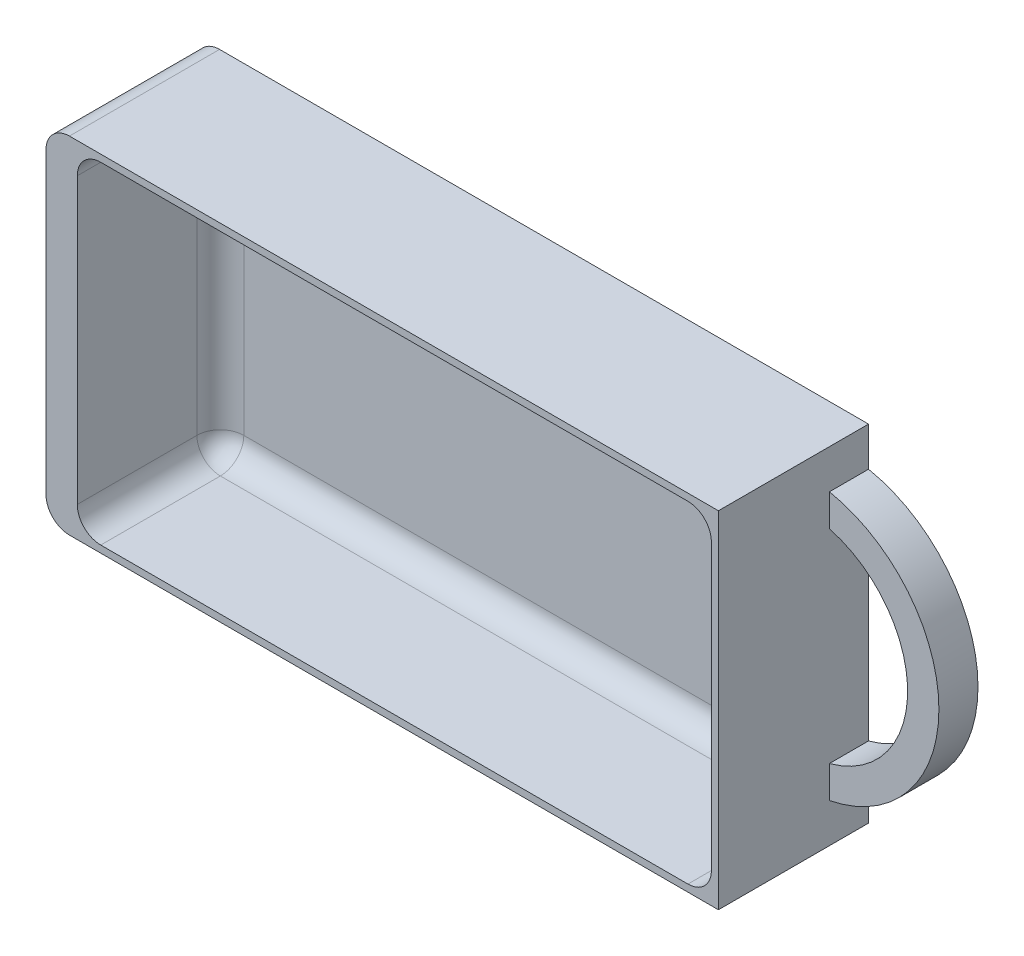
from build123d import *

# Parameters (mm, degrees)
SKETCH_1_W                  = 86
SKETCH_1_H                  = 44.2
EXTRUDE_1_DEPTH             = 14.2
EXTRUDE_2_DEPTH             = 5
SKETCH_3_W                  = 81.1
SKETCH_3_H                  = 42.4
CUT_EXTRUDE_1_DEPTH         = 18.3
HOLE_WIZARD_8_3_8_3_1_D     = 8.3
HOLE_WIZARD_8_3_8_3_1_DEPTH = 3.2
FILLET_1_R                  = 3
FILLET_2_R                  = 3
FILLET_3_R                  = 3
FILLET_4_R                  = 3
FILLET_5_R                  = 3
EXTRUDE_START               = -3
SKETCH_6_R                  = 4.15
EXTRUDE_3_DEPTH             = 3


with BuildPart() as part:
    # Эскиз1 → Бобышка-Вытянуть1 (new body)
    with BuildSketch(Plane.XY.offset(9.6)):
        with Locations((47, 0)):
            Rectangle(SKETCH_1_W, SKETCH_1_H)
    extrude(amount=-EXTRUDE_1_DEPTH)

    # Эскиз2 → Бобышка-Вытянуть2 (add)
    with BuildSketch(Plane(origin=(0, 0, -4.6), x_dir=(-1, 0, 0), z_dir=(0, 0, -1))):
        with BuildLine():
            Line((-90, -22.1), (-90, -17.1))
            ThreePointArc((-90, -17.1), (-104, 0), (-90, 17.1))
            Line((-90, 17.1), (-90, 22.1))
            Line((-90, 22.1), (-4, 22.1))
            Line((-4, 22.1), (-4, -22.1))
            Line((-4, -22.1), (-90, -22.1))
        make_face()
        with BuildLine():
            Line((-90, -12.994779171), (-90, 12.994779171))
            ThreePointArc((-90, 12.994779171), (-100, 0), (-90, -12.994779171))
        make_face(mode=Mode.SUBTRACT)
    extrude(amount=EXTRUDE_2_DEPTH)

    # Эскиз3 → Вырез-Вытянуть1 (cut)
    with BuildSketch(Plane.XY.offset(9.6)):
        with Locations((48.55, 0)):
            Rectangle(SKETCH_3_W, SKETCH_3_H)
    extrude(amount=-CUT_EXTRUDE_1_DEPTH, mode=Mode.SUBTRACT)

    # Диаметр отверстия Ø8.3 (8.3)1
    with Locations(Plane.ZY.offset(-4)):
        with Locations((0, 0)):
            Hole(HOLE_WIZARD_8_3_8_3_1_D / 2, depth=HOLE_WIZARD_8_3_8_3_1_DEPTH)

    # Скругление1
    fillet_1_edges = [part.edges().sort_by_distance(p)[0] for p in [
        (4, -22.1, 0),
        (4, 22.1, 0),
    ]]
    fillet(fillet_1_edges, radius=FILLET_1_R)

    # Скругление2
    fillet_2_edges = [part.edges().sort_by_distance(p)[0] for p in [
        (48.55, -21.2, -8.7),
    ]]
    fillet(fillet_2_edges, radius=FILLET_2_R)

    # Скругление3
    fillet_3_edges = [part.edges().sort_by_distance(p)[0] for p in [
        (48.55, 21.2, -8.7),
    ]]
    fillet(fillet_3_edges, radius=FILLET_3_R)

    # Скругление4
    fillet_4_edges = [part.edges().sort_by_distance(p)[0] for p in [
        (8, -21.2, 1.95),
        (8, -20.321320344, -7.821320344),
        (8, 0, -8.7),
        (8, 21.2, 1.95),
        (8, 20.321320344, -7.821320344),
    ]]
    fillet(fillet_4_edges, radius=FILLET_4_R)

    # Скругление5
    fillet_5_edges = [part.edges().sort_by_distance(p)[0] for p in [
        (89.1, -21.2, 1.95),
        (89.1, 0, -8.7),
        (89.1, -20.321320344, -7.821320344),
        (89.1, 21.2, 1.95),
        (89.1, 20.321320344, -7.821320344),
    ]]
    fillet(fillet_5_edges, radius=FILLET_5_R)

    # Эскиз6 → Бобышка-Вытянуть3 (add)
    with BuildSketch(Plane.ZY.offset(-4).offset(EXTRUDE_START)):
        Circle(SKETCH_6_R)
    extrude(amount=EXTRUDE_3_DEPTH)


solid = part.part
